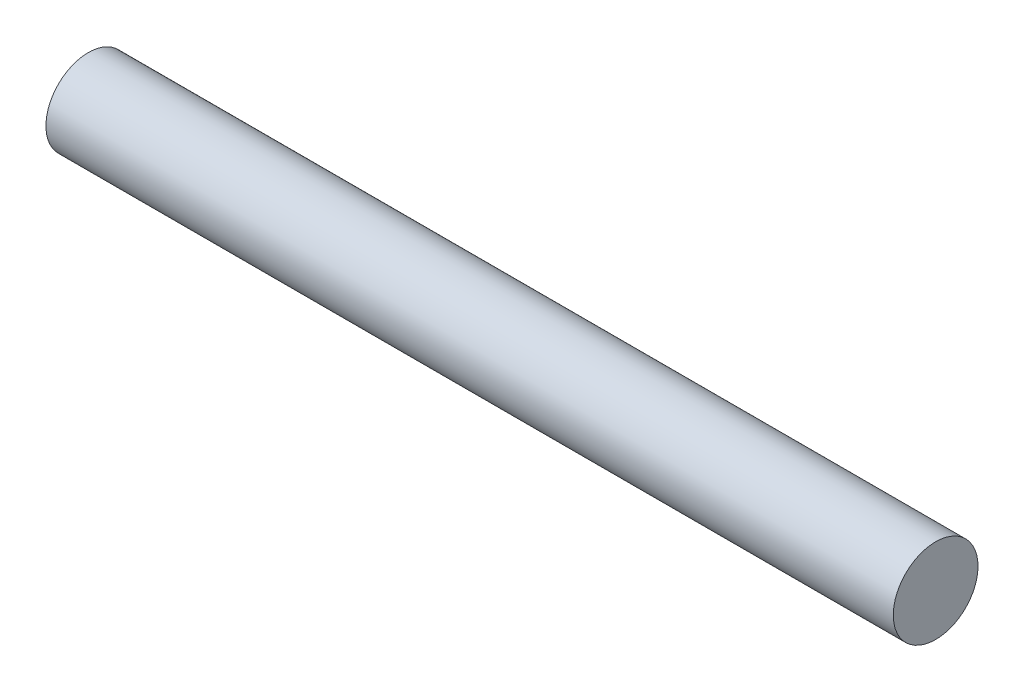
from build123d import *

# Parameters (mm, degrees)
SKETCH_1_R      = 1.5
EXTRUDE_1_DEPTH = 30


with BuildPart() as part:
    # 草图1 → 凸台-拉伸1 (new body)
    with BuildSketch(Plane(origin=(0, 0, 0), x_dir=(0, 0, -1), z_dir=(1, 0, 0))):
        Circle(SKETCH_1_R)
    extrude(amount=EXTRUDE_1_DEPTH)


solid = part.part
